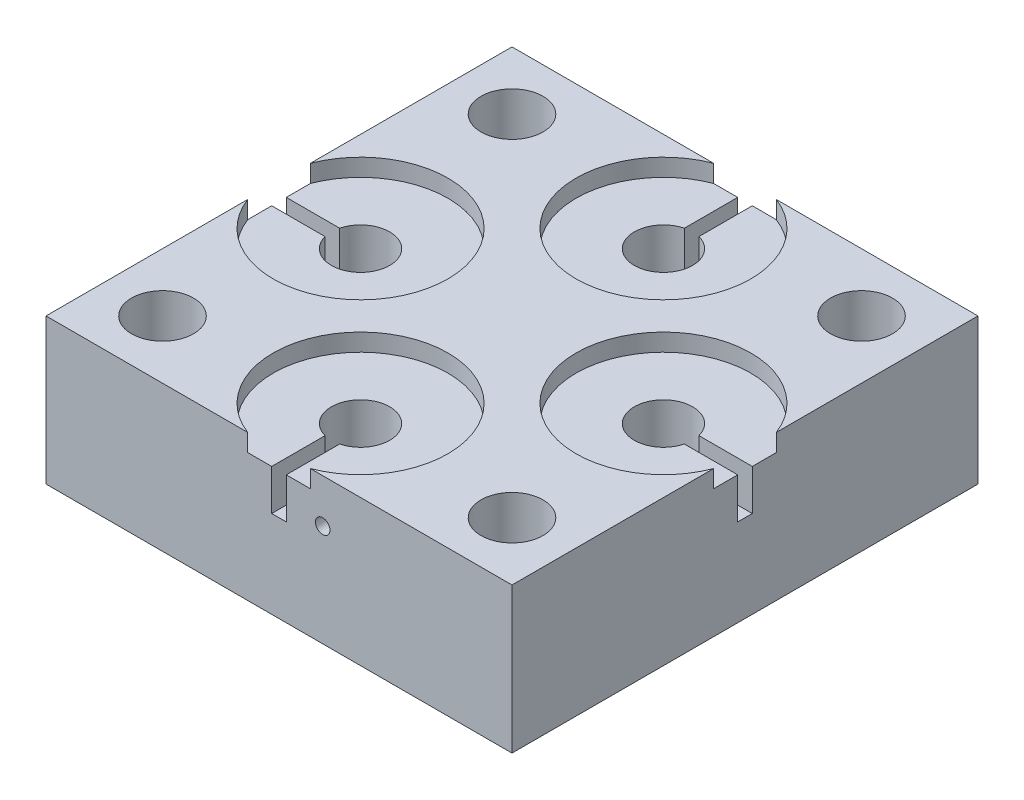
from build123d import *

# Parameters (mm, degrees)
SKETCH1_W               = 50.8
SKETCH1_H               = 50.8
BOSS_EXTRUDE1_DEPTH     = 15.875
F_1_4_CLEARANCE_HOLE1_D = 6.7564
SKETCH7_R               = 3.175
CUT_EXTRUDE2_DEPTH      = 9.525
F_6_CLEARANCE_HOLE1_D   = 3.7973
SKETCH15_R              = 6.35
CUT_EXTRUDE5_DEPTH      = 3.175
SKETCH17_R              = 0.79375
CUT_EXTRUDE7_DEPTH      = 19.05
SKETCH19_R              = 0.79375
CUT_EXTRUDE8_DEPTH      = 19.05
SKETCH20_W              = 1.5875
SKETCH20_H              = 8.919384601
SKETCH20_W_2            = 8.609080127
SKETCH20_H_2            = 1.5875
SKETCH20_W_3            = 9.022819426
SKETCH20_H_3            = 8.367732203
CUT_EXTRUDE9_DEPTH      = 6.35
SKETCH21_R              = 9.525
CUT_EXTRUDE10_DEPTH     = 1.905


with BuildPart() as part:
    # Sketch1 → Boss-Extrude1 (new body)
    with BuildSketch(Plane(origin=(0, 0, 0), x_dir=(1, 0, 0), z_dir=(0, 1, 0))):
        Rectangle(SKETCH1_W, SKETCH1_H)
    extrude(amount=BOSS_EXTRUDE1_DEPTH)

    # 1/4 Clearance Hole1 (through all)
    with Locations(Plane(origin=(0, 15.875, 0), x_dir=(1, 0, 0), z_dir=(0, 1, 0))):
        with Locations((-19.05, -19.05), (-19.05, 19.05), (19.05, 19.05), (19.05, -19.05)):
            Hole(F_1_4_CLEARANCE_HOLE1_D / 2)

    # Sketch7 → Cut-Extrude2 (cut)
    with BuildSketch(Plane(origin=(0, 15.875, 0), x_dir=(1, 0, 0), z_dir=(0, 1, 0))):
        with Locations(Location((-16.51, 0, 0), (0, 0, 270))):
            Circle(SKETCH7_R)
        with Locations(Location((0, 16.51, 0), (0, 0, 270))):
            Circle(SKETCH7_R)
        with Locations(Location((16.51, 0, 0), (0, 0, 270))):
            Circle(SKETCH7_R)
        with Locations(Location((0, -16.51, 0), (0, 0, 270))):
            Circle(SKETCH7_R)
    extrude(amount=-CUT_EXTRUDE2_DEPTH, mode=Mode.SUBTRACT)

    # #6 Clearance Hole1 (through all)
    with Locations(Plane(origin=(0, 6.35, 0), x_dir=(1, 0, 0), z_dir=(0, 1, 0))):
        with Locations((-16.51, 0), (0, 16.51), (16.51, 0), (0, -16.51)):
            Hole(F_6_CLEARANCE_HOLE1_D / 2)

    # Sketch15 → Cut-Extrude5 (cut)
    with BuildSketch(Plane.XZ):
        with Locations(Location((0, 16.51, 0), (0, 0, 270))):
            Circle(SKETCH15_R)
        with Locations(Location((16.51, 0, 0), (0, 0, 270))):
            Circle(SKETCH15_R)
        with Locations(Location((0, -16.51, 0), (0, 0, 270))):
            Circle(SKETCH15_R)
        with Locations(Location((-16.51, 0, 0), (0, 0, 270))):
            Circle(SKETCH15_R)
    extrude(amount=-CUT_EXTRUDE5_DEPTH, mode=Mode.SUBTRACT)

    # Sketch17 → Cut-Extrude7 (cut)
    with BuildSketch(Plane.XY.offset(25.4)):
        with Locations((4.7625, 11.1125)):
            Circle(SKETCH17_R)
    extrude(amount=-CUT_EXTRUDE7_DEPTH, mode=Mode.SUBTRACT)

    # Sketch19 → Cut-Extrude8 (cut)
    with BuildSketch(Plane(origin=(0, 0, -25.4), x_dir=(-1, 0, 0), z_dir=(0, 0, -1))):
        with Locations((4.7625, 11.1125)):
            Circle(SKETCH19_R)
    extrude(amount=-CUT_EXTRUDE8_DEPTH, mode=Mode.SUBTRACT)

    # Sketch20 → Cut-Extrude9 (cut)
    with BuildSketch(Plane(origin=(0, 15.875, 0), x_dir=(1, 0, 0), z_dir=(0, 1, 0))):
        with Locations((0, 20.9403077)):
            Rectangle(SKETCH20_W, SKETCH20_H)
        with Locations((-21.095459936, 0)):
            Rectangle(SKETCH20_W_2, SKETCH20_H_2)
        with Locations((20.888590287, 0)):
            Rectangle(SKETCH20_W_3, SKETCH20_H_2)
        with Locations((0, -21.216133899)):
            Rectangle(SKETCH20_W, SKETCH20_H_3)
    extrude(amount=-CUT_EXTRUDE9_DEPTH, mode=Mode.SUBTRACT)

    # Sketch21 → Cut-Extrude10 (cut)
    with BuildSketch(Plane(origin=(0, 15.875, 0), x_dir=(1, 0, 0), z_dir=(0, 1, 0))):
        with Locations((-16.51, 0)):
            Circle(SKETCH21_R)
        with Locations((16.51, 0)):
            Circle(SKETCH21_R)
        with Locations((0, 16.51)):
            Circle(SKETCH21_R)
        with Locations((0, -16.51)):
            Circle(SKETCH21_R)
    extrude(amount=-CUT_EXTRUDE10_DEPTH, mode=Mode.SUBTRACT)


solid = part.part
